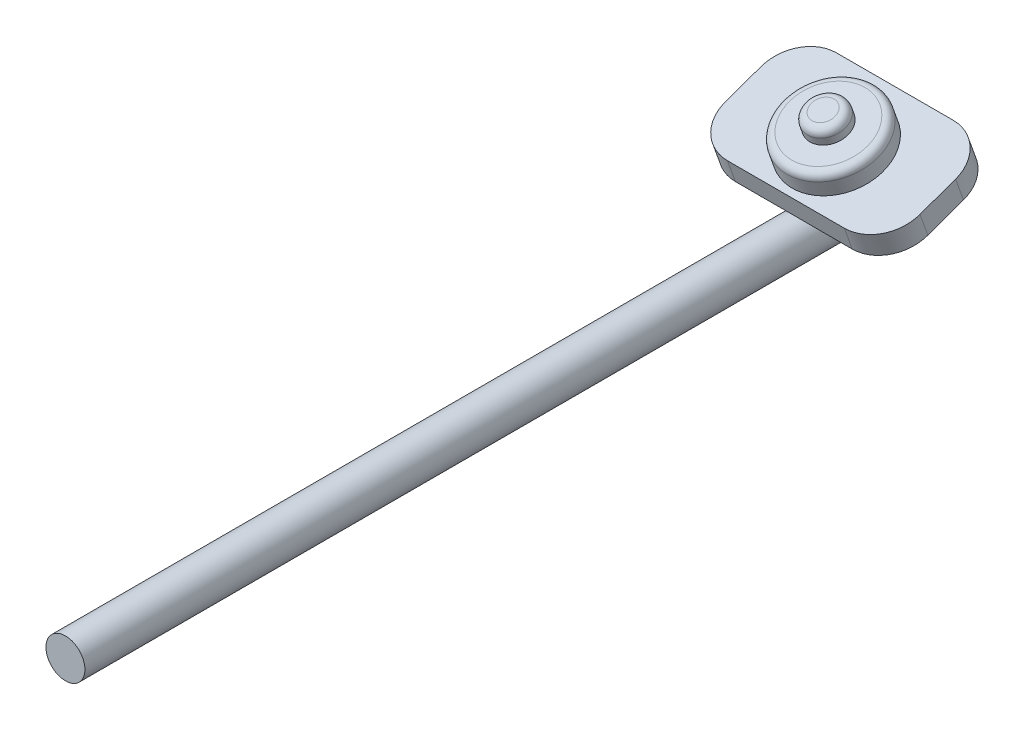
from build123d import *

# Parameters (mm, degrees)
SKETCH_1_R          = 2.5
EXTRUDE_1_DEPTH     = 100
SKETCH_2_W          = 25
SKETCH_2_H          = 15
EXTRUDE_2_DEPTH     = 15
CUT_EXTRUDE_1_DEPTH = 105.16333328
CUT_EXTRUDE_3_DEPTH = 104.593463815
SKETCH_1_2_R        = 2.5
EXTRUDE_3_DEPTH     = 20
SKETCH_5_R          = 6
EXTRUDE_4_DEPTH     = 3
SKETCH_5_3_R        = 2.5
EXTRUDE_5_DEPTH     = 5
FILLET_1_R          = 5
FILLET_2_R          = 1
FILLET_3_R          = 1


with BuildPart() as part:
    # 草图1 → 凸台-拉伸1 (new body)
    with BuildSketch(Plane.XY):
        Circle(SKETCH_1_R)
    extrude(amount=EXTRUDE_1_DEPTH)

    # 草图2 → 凸台-拉伸2 (add)
    with BuildSketch(Plane(origin=(0, 0, 0), x_dir=(1, 0, 0), z_dir=(0, 1, 0))):
        Rectangle(SKETCH_2_W, SKETCH_2_H)
    extrude(amount=EXTRUDE_2_DEPTH)

    # 草图4 → 切除-拉伸1 (cut, through all)
    with BuildSketch(Plane.ZY.offset(12.5)):
        Polygon((-7.5, 7.5), (-6.490375252, 10.325005817), (7.5, 5.325005817), (7.5, 15), (-7.5, 15), align=None)
        Polygon((7.5, 5.325005817), (6.490375252, 2.5), (7.5, 2.13917167), align=None)
    extrude(amount=-CUT_EXTRUDE_1_DEPTH, mode=Mode.SUBTRACT)

    # 草图4<3> → 切除-拉伸3 (cut, through all)
    with BuildSketch(Plane.ZY.offset(12.5)):
        Polygon((6.490375252, 2.5), (-7.5, 7.5), (-7.5, 0), (7.5, 0), (7.5, 2.13917167), align=None)
    extrude(amount=-CUT_EXTRUDE_3_DEPTH, mode=Mode.SUBTRACT)


with BuildPart() as cut_extrude_3_piece_1:
    # of the separate pieces the step leaves, piece 1, a body of its own (cut_extrude_3_pieces)
    add(part.part.solids().sort_by_distance((2.5, 0, 0))[0])

    # 草图1<2> → 凸台-拉伸3 (add)
    with BuildSketch(Plane.XY):
        Circle(SKETCH_1_2_R)
    extrude(amount=EXTRUDE_3_DEPTH)


with BuildPart() as cut_extrude_3_piece_2:
    # of the separate pieces the step leaves, piece 2, a body of its own (cut_extrude_3_pieces)
    add(part.part.solids().sort_by_distance((-12.5, 7.5, -7.5))[0])

    # 草图5 → 凸台-拉伸4 (add)
    with BuildSketch(Plane(origin=(0, 7.098724219, 2.537002793), x_dir=(1, 0, 0), z_dir=(0, 0.9416686058037751, 0.33654158263663997))):
        with Locations((0, 1.586576413)):
            Circle(SKETCH_5_R)
    extrude(amount=EXTRUDE_4_DEPTH)

    # 草图5<3> → 凸台-拉伸5 (add)
    with BuildSketch(Plane(origin=(0, 7.098724219, 2.537002793), x_dir=(1, 0, 0), z_dir=(0, 0.9416686058037751, 0.33654158263663997))):
        with Locations((0, 1.586576413)):
            Circle(SKETCH_5_3_R)
    extrude(amount=EXTRUDE_5_DEPTH)

    # 圆角1
    fillet_1_edges = [cut_extrude_3_piece_2.edges().sort_by_distance(p)[0] for p in [
        (12.5, 8.912502909, -6.995187626),
        (12.5, 3.912502909, 6.995187626),
        (-12.5, 8.912502909, -6.995187626),
        (-12.5, 3.912502909, 6.995187626),
    ]]
    fillet(fillet_1_edges, radius=FILLET_1_R)

    # 圆角2
    fillet_2_edges = [cut_extrude_3_piece_2.edges().sort_by_distance(p)[0] for p in [
        (-6, 10.457678974, 2.052598342),
    ]]
    fillet(fillet_2_edges, radius=FILLET_2_R)

    # 圆角3
    fillet_3_edges = [cut_extrude_3_piece_2.edges().sort_by_distance(p)[0] for p in [
        (-2.5, 12.341016185, 2.725681508),
    ]]
    fillet(fillet_3_edges, radius=FILLET_3_R)


solid = Compound([cut_extrude_3_piece_1.part, cut_extrude_3_piece_2.part])
